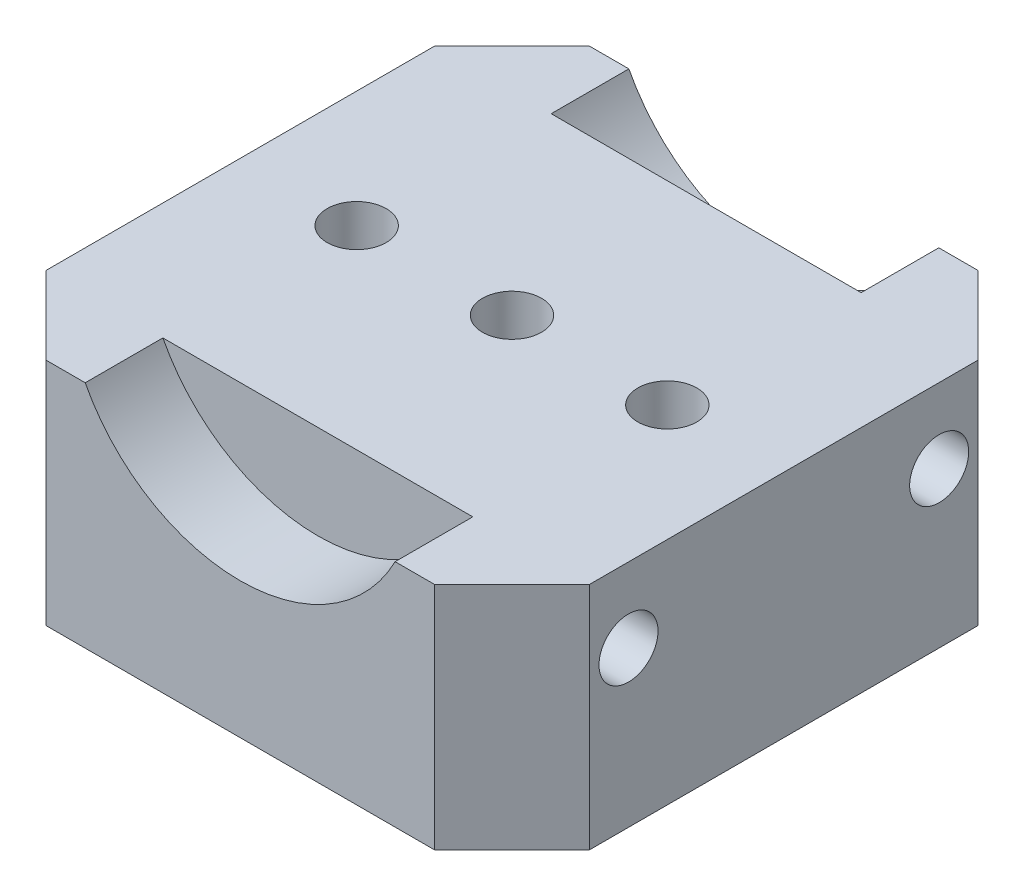
from build123d import *

# Parameters (mm, degrees)
SKETCH1_R           = 2.413
BOSS_EXTRUDE1_DEPTH = 44.45
SKETCH2_R           = 2.413
CUT_EXTRUDE1_DEPTH  = 50.8
SKETCH3_W           = 44.45
SKETCH3_H           = 25.654
CUT_EXTRUDE2_DEPTH  = 77.989658396
SKETCH4_R           = 14.2875
CUT_EXTRUDE3_DEPTH  = 6.35


with BuildPart() as part:
    # Sketch1 → Boss-Extrude1 (new body)
    with BuildSketch(Plane(origin=(0, 0, 0), x_dir=(1, 0, 0), z_dir=(0, 1, 0))):
        Polygon((0, 38.1), (6.35, 44.45), (38.1, 44.45), (44.45, 38.1), (44.45, 6.35), (38.1, 0), (6.35, 0), (0, 6.35), align=None)
        with Locations(Location((9.525, 22.225, 0), (0, 0, 270))):
            Circle(SKETCH1_R, mode=Mode.SUBTRACT)
        with Locations(Location((22.225, 22.225, 0), (0, 0, 270))):
            Circle(SKETCH1_R, mode=Mode.SUBTRACT)
        with Locations(Location((34.925, 22.225, 0), (0, 0, 270))):
            Circle(SKETCH1_R, mode=Mode.SUBTRACT)
    extrude(amount=BOSS_EXTRUDE1_DEPTH)

    # Sketch2 → Cut-Extrude1 (cut)
    with BuildSketch(Plane(origin=(44.45, 0, 0), x_dir=(0, 0, -1), z_dir=(1, 0, 0))):
        with Locations((9.525, 31.75)):
            Circle(SKETCH2_R)
        with Locations((34.925, 31.75)):
            Circle(SKETCH2_R)
        with Locations((34.925, 12.7)):
            Circle(SKETCH2_R)
        with Locations((9.525, 12.7)):
            Circle(SKETCH2_R)
    extrude(amount=-CUT_EXTRUDE1_DEPTH, mode=Mode.SUBTRACT)

    # Sketch3 → Cut-Extrude2 (cut, through all)
    with BuildSketch(Plane(origin=(44.45, 0, 0), x_dir=(0, 0, -1), z_dir=(1, 0, 0))):
        with Locations((22.225, 31.623)):
            Rectangle(SKETCH3_W, SKETCH3_H)
    extrude(amount=-CUT_EXTRUDE2_DEPTH, mode=Mode.SUBTRACT)

    # Sketch4 → Cut-Extrude3 (cut)
    with BuildSketch(Plane.XY):
        with Locations((22.225, 25.4)):
            Circle(SKETCH4_R)
    cut_extrude3 = extrude(amount=-CUT_EXTRUDE3_DEPTH, mode=Mode.SUBTRACT)

    # Mirror1: Cut-Extrude3 across plane
    add(cut_extrude3.mirror(Plane.XY.offset(-22.225)), mode=Mode.SUBTRACT)


solid = part.part
